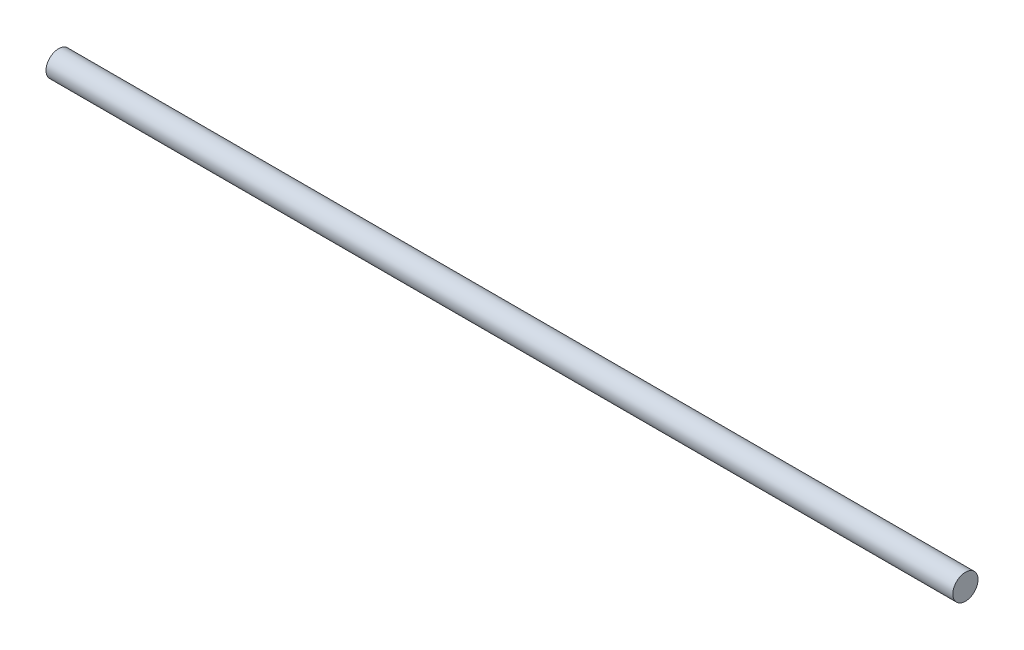
from build123d import *

# Parameters (mm, degrees)
SKETCH_2_R      = 2.5
EXTRUDE_2_DEPTH = 180


with BuildPart() as part:
    # 草圖2 → 填料-伸長2 (new body)
    with BuildSketch(Plane(origin=(0, 0, 0), x_dir=(0, 0, -1), z_dir=(1, 0, 0))):
        with Locations((0, 18)):
            Circle(SKETCH_2_R)
    extrude(amount=EXTRUDE_2_DEPTH)


solid = part.part
